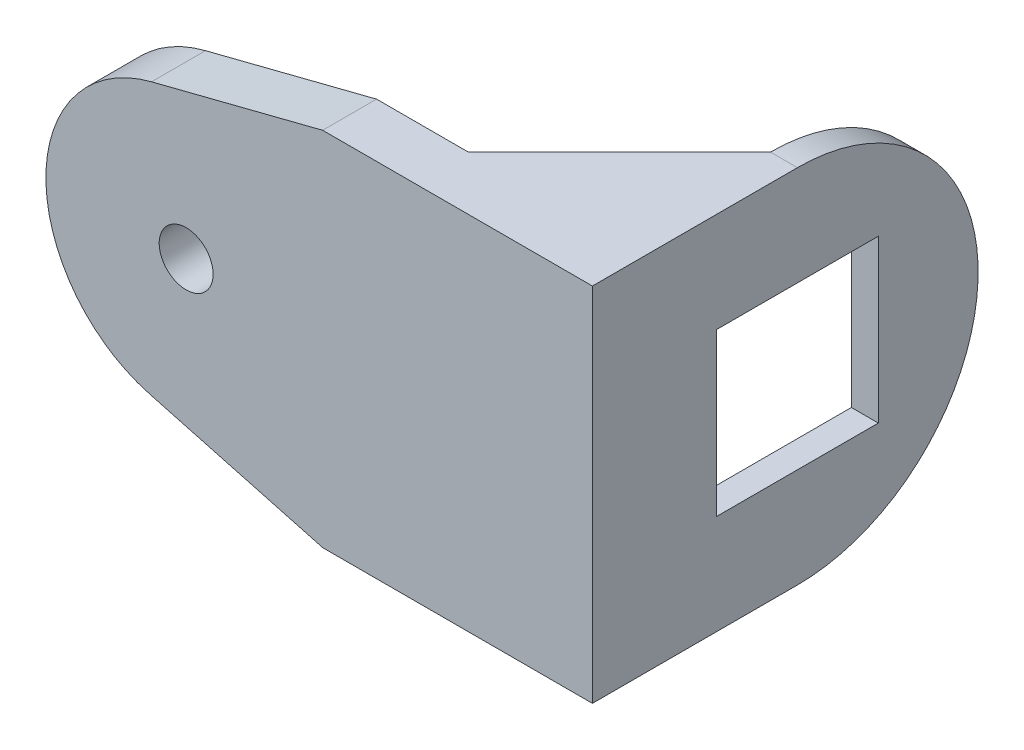
from build123d import *

# Parameters (mm, degrees)
SKETCH1_R           = 5
BOSS_EXTRUDE1_DEPTH = 10
SKETCH2_W           = 30
SKETCH2_H           = 30
BOSS_EXTRUDE2_DEPTH = 5
BOSS_EXTRUDE3_DEPTH = 5


with BuildPart() as part:
    # Sketch1 → Boss-Extrude1 (new body)
    with BuildSketch(Plane.XY):
        with BuildLine():
            Line((75.304851692, -33.724889915), (25.304851692, -33.724889915))
            Line((25.304851692, -33.724889915), (-6.749247564, -25.10871676))
            ThreePointArc((-6.749247564, -25.10871676), (-25.999433698, 0.171602352), (-6.417227169, 25.195618577))
            Line((-6.417227169, 25.195618577), (25.304851692, 33.275110085))
            Line((25.304851692, 33.275110085), (75.304851692, 33.275110085))
            Line((75.304851692, 33.275110085), (75.304851692, -33.724889915))
        make_face()
        Circle(SKETCH1_R, mode=Mode.SUBTRACT)
    extrude(amount=BOSS_EXTRUDE1_DEPTH)

    # Sketch2 → Boss-Extrude2 (add)
    with BuildSketch(Plane(origin=(75.304851692, 0, 0), x_dir=(0, 0, -1), z_dir=(1, 0, 0))):
        with BuildLine():
            Line((28, 33.275110085), (0, 33.275110085))
            Line((0, 33.275110085), (0, -33.724889915))
            Line((0, -33.724889915), (28, -33.724889915))
            ThreePointArc((28, -33.724889915), (61.5, -0.224889915), (28, 33.275110085))
        make_face()
        with Locations((28, -0.224889915)):
            Rectangle(SKETCH2_W, SKETCH2_H, mode=Mode.SUBTRACT)
    extrude(amount=-BOSS_EXTRUDE2_DEPTH)

    # Sketch3 → Boss-Extrude3 (add)
    with BuildSketch(Plane.XZ.offset(33.724889915)):
        Polygon((70.304851692, -28), (42.304851692, 0), (70.304851692, 0), align=None)
    boss_extrude3 = extrude(amount=-BOSS_EXTRUDE3_DEPTH)

    # Mirror1: Boss-Extrude3 across plane
    add(boss_extrude3.mirror(Plane.ZX.offset(-0.224889915)))


solid = part.part
